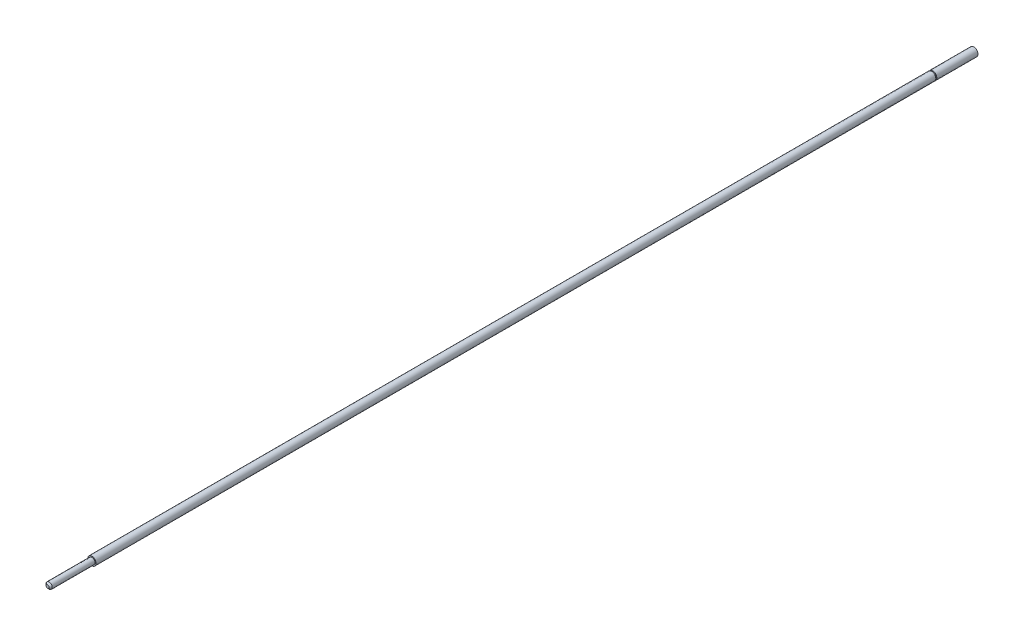
from build123d import *

# Parameters (mm, degrees)
SKETCH_1_R          = 4
EXTRUDE_1_DEPTH     = 39.5
SKETCH_2_R          = 3
EXTRUDE_2_DEPTH     = 1
SKETCH_3_R          = 4
EXTRUDE_3_DEPTH     = 805.5
SKETCH_4_R          = 3
EXTRUDE_4_DEPTH     = 42.5
CUT_EXTRUDE_1_DEPTH = 5
CHAMFER_1_SIZE      = 1.5


with BuildPart() as part:
    # 草图1 → 凸台-拉伸1 (new body)
    with BuildSketch(Plane.XY):
        Circle(SKETCH_1_R)
    extrude(amount=EXTRUDE_1_DEPTH)

    # 草图2 → 凸台-拉伸2 (add)
    with BuildSketch(Plane.XY.offset(39.5)):
        Circle(SKETCH_2_R)
    extrude(amount=EXTRUDE_2_DEPTH)

    # 草图3 → 凸台-拉伸3 (add)
    with BuildSketch(Plane.XY.offset(40.5)):
        Circle(SKETCH_3_R)
    extrude(amount=EXTRUDE_3_DEPTH)

    # 草图4 → 凸台-拉伸4 (add)
    with BuildSketch(Plane.XY.offset(846)):
        Circle(SKETCH_4_R)
    extrude(amount=EXTRUDE_4_DEPTH)

    # 草图7 → 切除-拉伸1 (cut)
    with BuildSketch(Plane(origin=(0, 0, 0), x_dir=(-1, 0, 0), z_dir=(0, 0, -1))):
        Polygon((3, 0), (1.5, -2.598076211), (-1.5, -2.598076211), (-3, 0), (-1.5, 2.598076211), (1.5, 2.598076211), align=None)
    extrude(amount=-CUT_EXTRUDE_1_DEPTH, mode=Mode.SUBTRACT)

    # 倒角1
    chamfer_1_edges = [part.edges().sort_by_distance(p)[0] for p in [
        (-3, 0, 888.5),
    ]]
    chamfer(chamfer_1_edges, length=CHAMFER_1_SIZE)


solid = part.part
